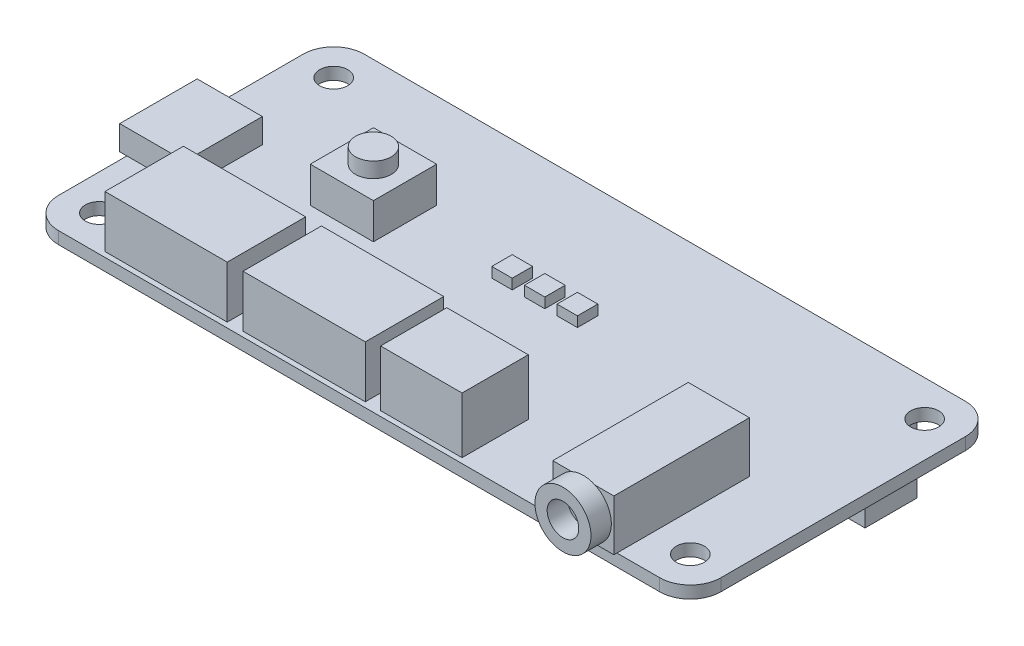
from build123d import *

# Parameters (mm, degrees)
EXTRUDE_1_DEPTH     = 1.2
SKETCH_2_R          = 1.375
CUT_EXTRUDE_1_DEPTH = 1.2
SKETCH_3_W          = 6
SKETCH_3_H          = 13
EXTRUDE_2_DEPTH     = 5
SKETCH_4_W          = 6
SKETCH_4_H          = 5
EXTRUDE_3_DEPTH     = 0.3
SKETCH_5_W          = 8
SKETCH_5_H          = 7
EXTRUDE_4_DEPTH     = 5.5
SKETCH_6_W          = 12
SKETCH_6_H          = 8.2
EXTRUDE_5_DEPTH     = 5.1
SKETCH_7_W          = 12
SKETCH_7_H          = 8.2
EXTRUDE_6_DEPTH     = 5.1
SKETCH_8_W          = 5.7
SKETCH_8_H          = 7.6
EXTRUDE_7_DEPTH     = 2.4
SKETCH_9_W          = 7.6
SKETCH_9_H          = 2.4
EXTRUDE_8_DEPTH     = 0.7
SKETCH_10_W         = 12
SKETCH_10_H         = 5.1
SKETCH_10_W_2       = 8
SKETCH_10_H_2       = 5.5
CUT_EXTRUDE_2_DEPTH = 0.5
SKETCH_11_W         = 51.4
SKETCH_11_H         = 5.1
EXTRUDE_9_DEPTH     = 8.5
SKETCH_12_W         = 6.2
SKETCH_12_H         = 6.2
EXTRUDE_10_DEPTH    = 3.5
SKETCH_13_R         = 1.75
EXTRUDE_11_DEPTH    = 1.5
SKETCH_14_W         = 2
SKETCH_14_H         = 2
EXTRUDE_12_DEPTH    = 1
SKETCH_15_R         = 2.75
SKETCH_15_R_2       = 1.55
EXTRUDE_13_DEPTH    = 2


with BuildPart() as part:
    # 草图1 → 凸台-拉伸1 (new body)
    with BuildSketch(Plane(origin=(0, 0, 0), x_dir=(1, 0, 0), z_dir=(0, 1, 0))):
        with BuildLine():
            Line((-29.5, 15), (29.5, 15))
            ThreePointArc((29.5, 15), (31.621320344, 14.121320344), (32.5, 12))
            Line((32.5, 12), (32.5, -12))
            ThreePointArc((32.5, -12), (31.621320344, -14.121320344), (29.5, -15))
            Line((29.5, -15), (-29.5, -15))
            ThreePointArc((-29.5, -15), (-31.621320344, -14.121320344), (-32.5, -12))
            Line((-32.5, -12), (-32.5, 12))
            ThreePointArc((-32.5, 12), (-31.621320344, 14.121320344), (-29.5, 15))
        make_face()
    extrude(amount=EXTRUDE_1_DEPTH)

    # 草图2 → 切除-拉伸1 (cut)
    with BuildSketch(Plane(origin=(0, 1.2, 0), x_dir=(1, 0, 0), z_dir=(0, 1, 0))):
        with Locations(Location((29, -11.5, 0), (0, 0, 270))):
            Circle(SKETCH_2_R)
        with Locations(Location((29, 11.5, 0), (0, 0, 270))):
            Circle(SKETCH_2_R)
        with Locations(Location((-29, -11.5, 0), (0, 0, 270))):
            Circle(SKETCH_2_R)
        with Locations(Location((-29, 11.5, 0), (0, 0, 270))):
            Circle(SKETCH_2_R)
    extrude(amount=-CUT_EXTRUDE_1_DEPTH, mode=Mode.SUBTRACT)

    # 草图3 → 凸台-拉伸2 (add)
    with BuildSketch(Plane(origin=(0, 1.2, 0), x_dir=(1, 0, 0), z_dir=(0, 1, 0))):
        with Locations((22.3, -8.5)):
            Rectangle(SKETCH_3_W, SKETCH_3_H)
    extrude(amount=EXTRUDE_2_DEPTH)

    # 草图4 → 凸台-拉伸3 (add)
    with BuildSketch(Plane.XY.offset(15)):
        with Locations((22.3, 3.7)):
            Rectangle(SKETCH_4_W, SKETCH_4_H)
    extrude(amount=EXTRUDE_3_DEPTH)

    # 草图5 → 凸台-拉伸4 (add)
    with BuildSketch(Plane(origin=(0, 1.2, 0), x_dir=(1, 0, 0), z_dir=(0, 1, 0))):
        with Locations((5.6, -11.5)):
            Rectangle(SKETCH_5_W, SKETCH_5_H)
    extrude(amount=EXTRUDE_4_DEPTH)

    # 草图6 → 凸台-拉伸5 (add)
    with BuildSketch(Plane(origin=(0, 1.2, 0), x_dir=(1, 0, 0), z_dir=(0, 1, 0))):
        with Locations((-5.9, -10.9)):
            Rectangle(SKETCH_6_W, SKETCH_6_H)
    extrude(amount=EXTRUDE_5_DEPTH)

    # 草图7 → 凸台-拉伸6 (add)
    with BuildSketch(Plane(origin=(0, 1.2, 0), x_dir=(1, 0, 0), z_dir=(0, 1, 0))):
        with Locations((-19.45, -10.9)):
            Rectangle(SKETCH_7_W, SKETCH_7_H)
    extrude(amount=EXTRUDE_6_DEPTH)

    # 草图8 → 凸台-拉伸7 (add)
    with BuildSketch(Plane(origin=(0, 1.2, 0), x_dir=(1, 0, 0), z_dir=(0, 1, 0))):
        with Locations((-29.65, -1.5)):
            Rectangle(SKETCH_8_W, SKETCH_8_H)
    extrude(amount=EXTRUDE_7_DEPTH)

    # 草图9 → 凸台-拉伸8 (add)
    with BuildSketch(Plane.ZY.offset(32.5)):
        with Locations((1.5, 2.4)):
            Rectangle(SKETCH_9_W, SKETCH_9_H)
    extrude(amount=EXTRUDE_8_DEPTH)

    # 草图10 → 切除-拉伸2 (cut)
    with BuildSketch(Plane.XY.offset(15)):
        with Locations((-19.45, 3.75)):
            Rectangle(SKETCH_10_W, SKETCH_10_H)
        with Locations((-5.9, 3.75)):
            Rectangle(SKETCH_10_W, SKETCH_10_H)
        with Locations((5.6, 3.95)):
            Rectangle(SKETCH_10_W_2, SKETCH_10_H_2)
    extrude(amount=-CUT_EXTRUDE_2_DEPTH, mode=Mode.SUBTRACT)

    # 草图11 → 凸台-拉伸9 (add)
    with BuildSketch(Plane.XZ):
        with Locations((-0.05, -11.55)):
            Rectangle(SKETCH_11_W, SKETCH_11_H)
    extrude(amount=EXTRUDE_9_DEPTH)

    # 草图12 → 凸台-拉伸10 (add)
    with BuildSketch(Plane(origin=(0, 1.2, 0), x_dir=(1, 0, 0), z_dir=(0, 1, 0))):
        with Locations((-16.2, 2.6)):
            Rectangle(SKETCH_12_W, SKETCH_12_H)
    extrude(amount=EXTRUDE_10_DEPTH)

    # 草图13 → 凸台-拉伸11 (add)
    with BuildSketch(Plane(origin=(0, 4.7, 0), x_dir=(1, 0, 0), z_dir=(0, 1, 0))):
        with Locations(Location((-16.2, 2.6, 0), (0, 0, 270))):
            Circle(SKETCH_13_R)
    extrude(amount=EXTRUDE_11_DEPTH)

    # 草图14 → 凸台-拉伸12 (add)
    with BuildSketch(Plane(origin=(0, 1.2, 0), x_dir=(1, 0, 0), z_dir=(0, 1, 0))):
        with Locations((3.2, 3.22)):
            Rectangle(SKETCH_14_W, SKETCH_14_H)
        with Locations((0, 3.22)):
            Rectangle(SKETCH_14_W, SKETCH_14_H)
        with Locations((-3.2, 3.22)):
            Rectangle(SKETCH_14_W, SKETCH_14_H)
    extrude(amount=EXTRUDE_12_DEPTH)

    # 草图15 → 凸台-拉伸13 (add)
    with BuildSketch(Plane.XY.offset(15.3)):
        with Locations(Location((22.3, 3.7, 0), (0, 0, 114.619977329))):
            Circle(SKETCH_15_R)
        with Locations((22.3, 3.7)):
            Circle(SKETCH_15_R_2, mode=Mode.SUBTRACT)
    extrude(amount=EXTRUDE_13_DEPTH)


solid = part.part
